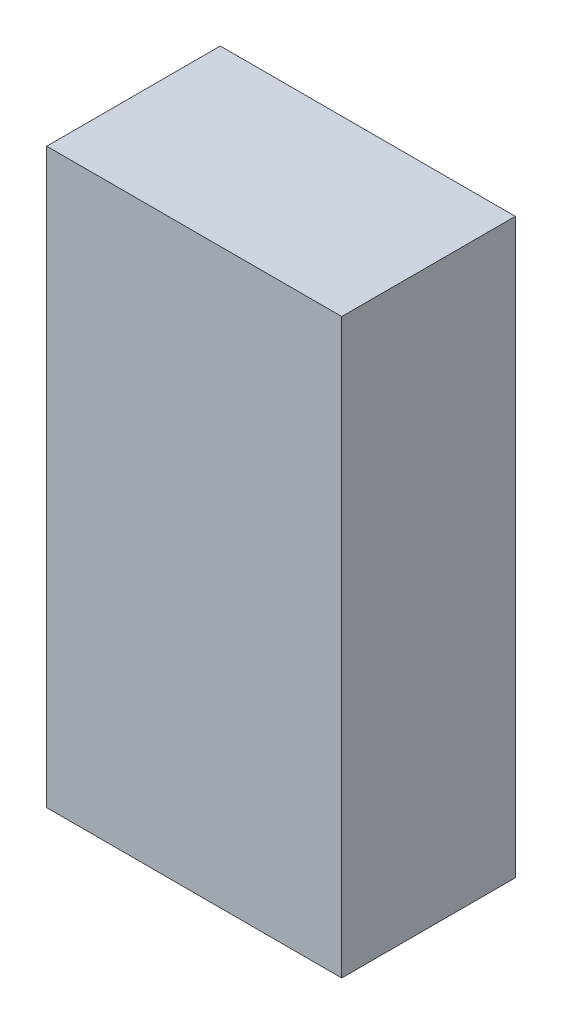
from build123d import *

# Parameters (mm, degrees)
SKIZZE1_W               = 1.7
SKIZZE1_H               = 3.3008
COMPONENT_OUTLINE_DEPTH = 1


with BuildPart() as part:
    # Skizze1 → Component_Outline (new body)
    with BuildSketch(Plane.XY):
        with Locations((0, 0.0004)):
            Rectangle(SKIZZE1_W, SKIZZE1_H)
    extrude(amount=COMPONENT_OUTLINE_DEPTH)


solid = part.part
